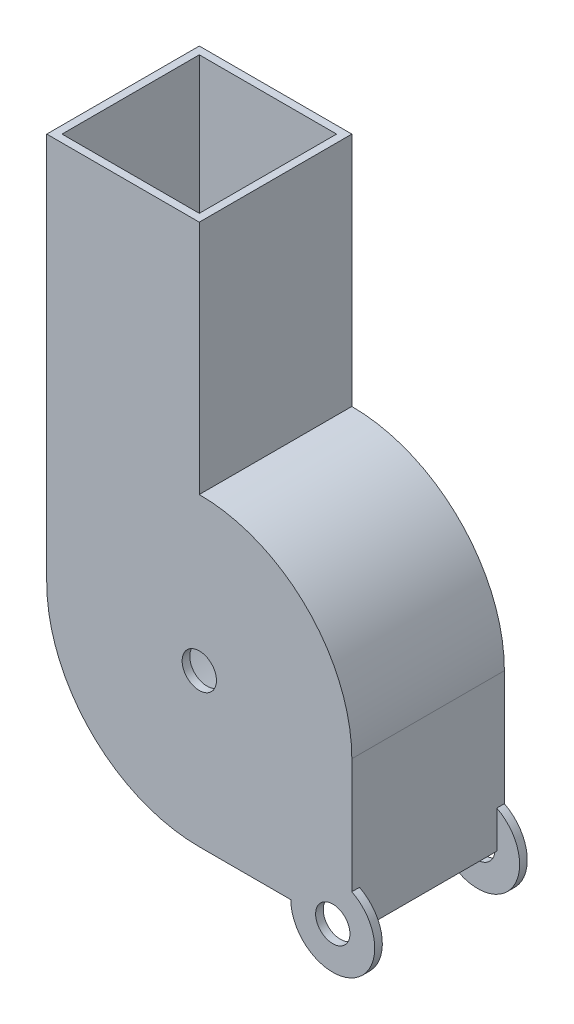
from build123d import *

# Parameters (mm, degrees)
BOSS_EXTRUDE1_DEPTH = 40
SHELL1_T            = -2
SKETCH2_W           = 36
SKETCH2_H           = 36
CUT_EXTRUDE1_DEPTH  = 40
SKETCH7_R           = 11
BOSS_EXTRUDE3_DEPTH = 2
CUT_EXTRUDE4_REACH  = 120.704
SKETCH8_R           = 4.5
BOSS_EXTRUDE4_START = -2
SKETCH9_R           = 11
BOSS_EXTRUDE4_DEPTH = 2
SKETCH10_R          = 4.5
CUT_EXTRUDE5_DEPTH  = 119.70397032


with BuildPart() as part:
    # Sketch1 → Boss-Extrude1 (new body)
    with BuildSketch(Plane.XY):
        with BuildLine():
            Line((-40, 0), (-40, 101.855940277))
            Line((-40, 101.855940277), (0, 101.855940277))
            Line((0, 101.855940277), (0, 40))
            ThreePointArc((0, 40), (28.284271247, 28.284271247), (40, 0))
            Line((40, 0), (40, -40))
            Line((40, -40), (0, -40))
            ThreePointArc((0, -40), (-28.284271247, -28.284271247), (-40, 0))
        make_face()
    extrude(amount=BOSS_EXTRUDE1_DEPTH)

    # Shell1
    shell1_openings = [part.faces().sort_by_distance(p)[0] for p in [
        (-20, 101.855940277, 20),
    ]]
    offset(amount=SHELL1_T, openings=shell1_openings, kind=Kind.INTERSECTION)

    # Sketch2 → Cut-Extrude1 (cut)
    with BuildSketch(Plane.XZ.offset(40)):
        with Locations((20, 20)):
            Rectangle(SKETCH2_W, SKETCH2_H)
    extrude(amount=-CUT_EXTRUDE1_DEPTH, mode=Mode.SUBTRACT)

    # Sketch7 → Boss-Extrude3 (add)
    with BuildSketch(Plane.XY.offset(40)):
        with Locations((35, -40)):
            Circle(SKETCH7_R)
    extrude(amount=-BOSS_EXTRUDE3_DEPTH)

    # Cut-Extrude4: up to this face of the body (flat: up to its plane)
    cut_extrude4_end = Plane(part.part.faces().sort_by_distance((-6.043930541, 21.434186246, 0))[0])
    # Sketch8 → Cut-Extrude4 (cut, up to the picked face)
    with BuildSketch(Plane.XY.offset(40), mode=Mode.PRIVATE) as cut_extrude4_sk1:
        Circle(SKETCH8_R)
    cut_extrude4_tool1 = split(extrude(cut_extrude4_sk1.sketch, amount=-CUT_EXTRUDE4_REACH, mode=Mode.PRIVATE), bisect_by=cut_extrude4_end, keep=Keep.BOTH, mode=Mode.PRIVATE)
    add(cut_extrude4_tool1.solids().sort_by(Axis((0, 0, 40), (0, 0, -1)))[0], mode=Mode.SUBTRACT)

    # Sketch9 → Boss-Extrude4 (add)
    with BuildSketch(Plane(origin=(0, 0, 0), x_dir=(-1, 0, 0), z_dir=(0, 0, -1)).offset(BOSS_EXTRUDE4_START)):
        with Locations((-35, -40)):
            Circle(SKETCH9_R)
    extrude(amount=BOSS_EXTRUDE4_DEPTH)

    # Sketch10 → Cut-Extrude5 (cut, through all)
    with BuildSketch(Plane.XY.offset(40)):
        with Locations((35, -40)):
            Circle(SKETCH10_R)
    extrude(amount=-CUT_EXTRUDE5_DEPTH, mode=Mode.SUBTRACT)


solid = part.part
